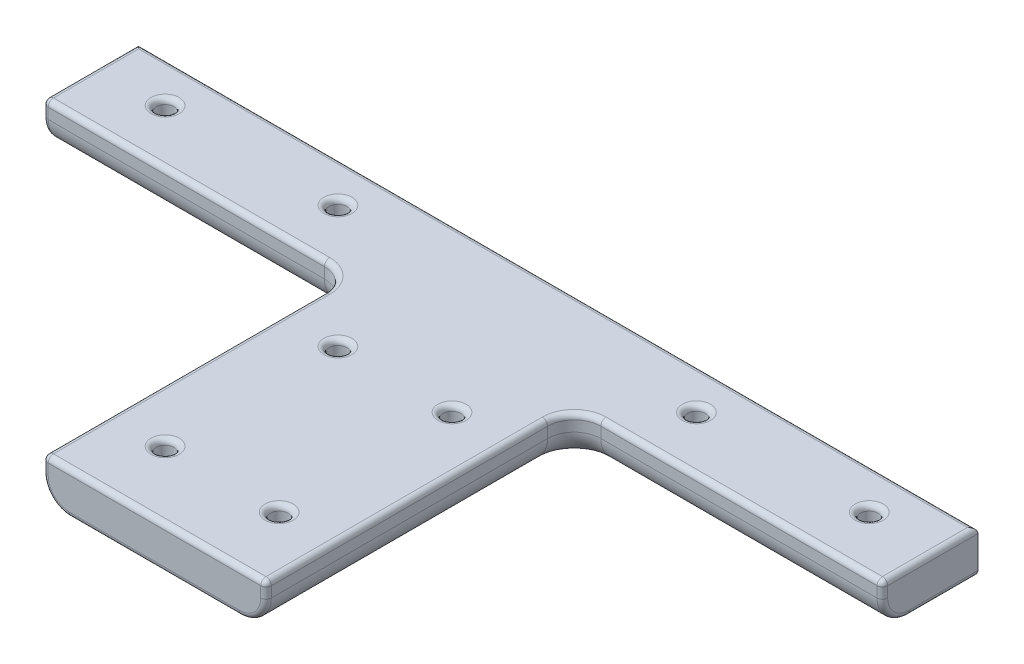
from build123d import *

# Parameters (mm, degrees)
BOSS_EXTRUDE1_DEPTH = 8
SKETCH6_R           = 1.65
CUT_EXTRUDE1_DEPTH  = 8
FILLET1_R           = 5
FILLET3_R           = 5
FILLET4_R           = 1


with BuildPart() as part:
    # Sketch2 → Boss-Extrude1 (new body)
    with BuildSketch(Plane(origin=(0, 0, 0), x_dir=(1, 0, 0), z_dir=(0, 1, 0))):
        Polygon((-21, -29), (21, -29), (21, 29), (79, 29), (79, 47), (-79, 47), (-79, 29), (-21, 29), align=None)
    extrude(amount=-BOSS_EXTRUDE1_DEPTH)

    # Sketch6 → Cut-Extrude1 (cut)
    with BuildSketch(Plane(origin=(0, 0, 0), x_dir=(1, 0, 0), z_dir=(0, 1, 0))):
        with Locations(Location((-10.735119868, -16.264045876, 0), (0, 0, 270))):
            Circle(SKETCH6_R)
        with Locations(Location((-10.735119868, 16.264045876, 0), (0, 0, 270))):
            Circle(SKETCH6_R)
        with Locations(Location((10.735119868, 16.264045876, 0), (0, 0, 270))):
            Circle(SKETCH6_R)
        with Locations(Location((10.735119868, -16.264045876, 0), (0, 0, 270))):
            Circle(SKETCH6_R)
        with Locations(Location((-33.735954124, 39.264880132, 0), (0, 0, 270))):
            Circle(SKETCH6_R)
        with Locations(Location((-66.264045876, 39.264880132, 0), (0, 0, 270))):
            Circle(SKETCH6_R)
        with Locations(Location((66.264045876, 39.264880132, 0), (0, 0, 270))):
            Circle(SKETCH6_R)
        with Locations(Location((33.735954124, 39.264880132, 0), (0, 0, 270))):
            Circle(SKETCH6_R)
    extrude(amount=-CUT_EXTRUDE1_DEPTH, mode=Mode.SUBTRACT)

    # Fillet1
    fillet1_edges = [part.edges().sort_by_distance(p)[0] for p in [
        (-21, -4, -29),
        (21, -4, -29),
    ]]
    fillet(fillet1_edges, radius=FILLET1_R)

    # Fillet3
    fillet3_edges = [part.edges().sort_by_distance(p)[0] for p in [
        (21, -8, 2.5),
        (-52.5, -8, -29),
        (52.5, -8, -29),
        (-21, -8, 2.5),
        (22.464466094, -8, -27.535533906),
        (-22.464466094, -8, -27.535533906),
    ]]
    fillet(fillet3_edges, radius=FILLET3_R)

    # Fillet4
    fillet4_edges = [part.edges().sort_by_distance(p)[0] for p in [
        (21, 0, 2.5),
        (0, 0, 29),
        (0, -8, -47),
        (-79, -8, -40.5),
        (-33.735954124, 0, -40.914880132),
        (-33.735954124, -8, -40.914880132),
        (-66.264045876, 0, -40.914880132),
        (-66.264045876, -8, -40.914880132),
        (-10.735119868, 0, -17.914045876),
        (-10.735119868, -8, -17.914045876),
        (66.264045876, 0, -40.914880132),
        (66.264045876, -8, -40.914880132),
        (33.735954124, 0, -40.914880132),
        (33.735954124, -8, -40.914880132),
        (10.735119868, 0, -17.914045876),
        (10.735119868, -8, -17.914045876),
        (10.735119868, 0, 14.614045876),
        (10.735119868, -8, 14.614045876),
        (-10.735119868, 0, 14.614045876),
        (-10.735119868, -8, 14.614045876),
        (52.5, 0, -29),
        (-21, 0, 2.5),
        (22.464466094, 0, -27.535533906),
        (-22.464466094, 0, -27.535533906),
        (79, -1.5, -29),
        (79, -8, -40.5),
        (79, -6.535533906, -30.464466094),
        (0, -8, 29),
        (-79, -1.5, -29),
        (-79, -6.535533906, -30.464466094),
        (21, -1.5, 29),
        (-21, -1.5, 29),
        (-19.535533906, -6.535533906, 29),
        (19.535533906, -6.535533906, 29),
        (-52.5, 0, -29),
        (-79, 0, -38),
        (0, 0, -47),
        (79, 0, -38),
    ]]
    fillet(fillet4_edges, radius=FILLET4_R)


solid = part.part
